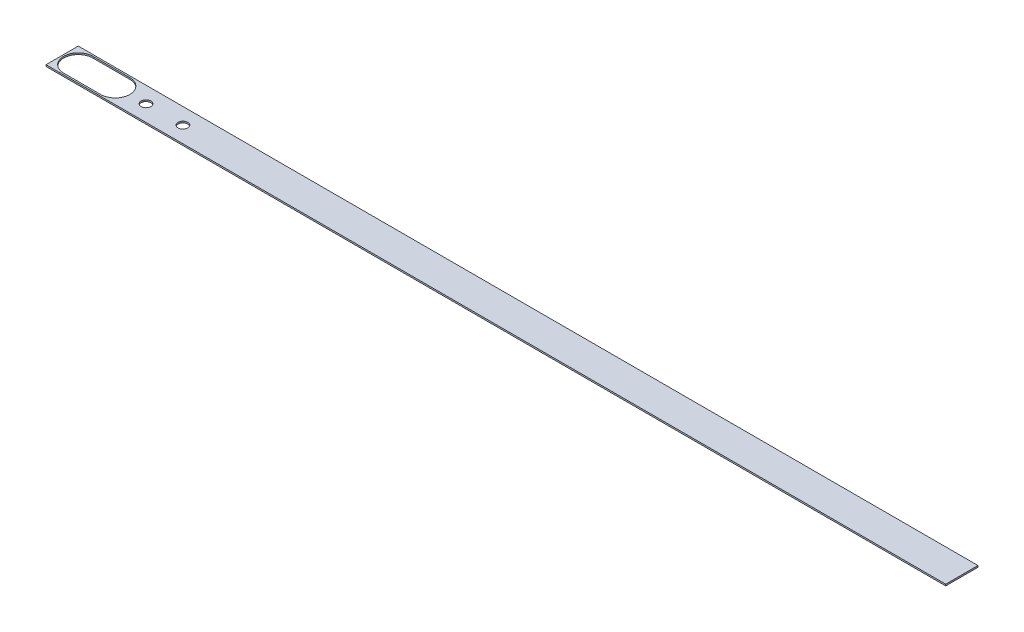
from build123d import *

# Parameters (mm, degrees)
SKETCH1_W           = 925
SKETCH1_H           = 33.2
BOSS_EXTRUDE1_DEPTH = 1.6
SKETCH2_R           = 5
CUT_EXTRUDE1_DEPTH  = 463.800572601


with BuildPart() as part:
    # Sketch1 → Boss-Extrude1 (new body)
    with BuildSketch(Plane(origin=(0, 0, 0), x_dir=(1, 0, 0), z_dir=(0, 1, 0))):
        Rectangle(SKETCH1_W, SKETCH1_H)
    extrude(amount=-BOSS_EXTRUDE1_DEPTH)

    # Sketch2 → Cut-Extrude1 (cut, through all)
    with BuildSketch(Plane(origin=(0, 0, 0), x_dir=(1, 0, 0), z_dir=(0, 1, 0))):
        with Locations((-376.3, 0)):
            Circle(SKETCH2_R)
        with Locations((-338.3, 0)):
            Circle(SKETCH2_R)
        with BuildLine():
            Line((-445.9, 15), (-407.9, 15))
            ThreePointArc((-407.9, 15), (-392.9, 0), (-407.9, -15))
            Line((-407.9, -15), (-445.9, -15))
            ThreePointArc((-445.9, -15), (-460.9, 0), (-445.9, 15))
        make_face()
    extrude(amount=-CUT_EXTRUDE1_DEPTH, mode=Mode.SUBTRACT)


solid = part.part
